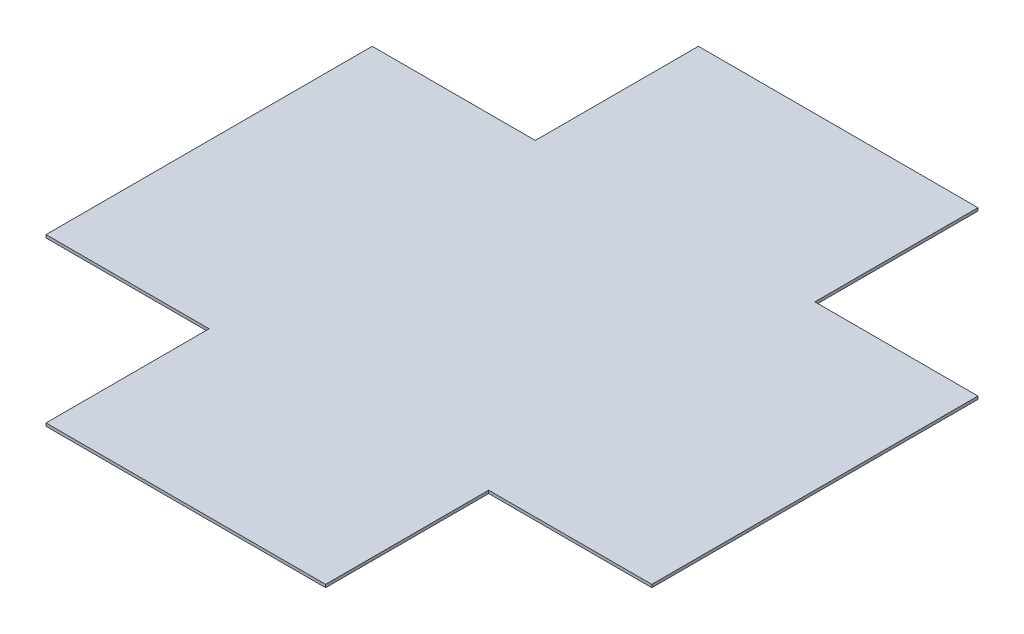
from build123d import *

# Parameters (mm, degrees)
SKETCH1_W           = 177.8
SKETCH1_H           = 355.6
SKETCH1_W_2         = 304.8
SKETCH1_H_2         = 177.8
BOSS_EXTRUDE1_DEPTH = 1.5875


with BuildPart() as part:
    # Sketch1 → Boss-Extrude1 (new, symmetric)
    with BuildSketch(Plane(origin=(0, 0, 0), x_dir=(1, 0, 0), z_dir=(0, 1, 0))):
        with Locations((-241.3, 0)):
            Rectangle(SKETCH1_W, SKETCH1_H)
        Rectangle(SKETCH1_W_2, SKETCH1_H)
        with Locations((0, 266.7)):
            Rectangle(SKETCH1_W_2, SKETCH1_H_2)
        with Locations((0, -266.7)):
            Rectangle(SKETCH1_W_2, SKETCH1_H_2)
        with Locations((241.3, 0)):
            Rectangle(SKETCH1_W, SKETCH1_H)
    extrude(amount=BOSS_EXTRUDE1_DEPTH, both=True)


solid = part.part
